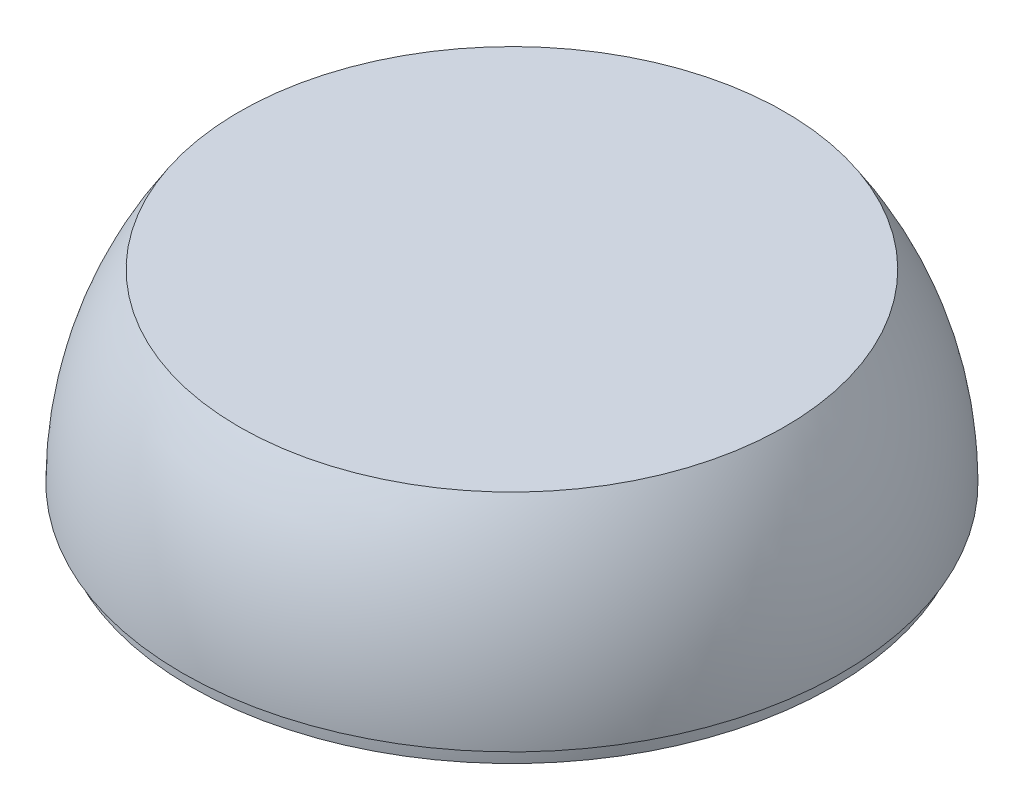
from build123d import *


with BuildPart() as part:
    # Sketch1 → Revolve3 (revolve)
    with BuildSketch(Plane.XY, mode=Mode.PRIVATE) as revolve3_sk:
        with BuildLine():
            Line((0, 0), (1, 0))
            ThreePointArc((1, 0), (1.012509778, -1.000312842), (1.050031289, -2))
            Line((1.050031289, -2), (2.051315812, -2))
            ThreePointArc((2.051315812, -2), (3.297318564, 9.975360272), (8.13664655, 21))
            Line((8.13664655, 21), (41, 21))
            Line((41, 21), (41, 23))
            Line((41, 23), (7.058874503, 23))
            ThreePointArc((7.058874503, 23), (1.804425343, 12.029419243), (0, 0))
        make_face()
    revolve(revolve3_sk.sketch.rotate(Axis((41, 23, 0), (0, -1, 0)), 270), axis=Axis((41, 23, 0), (0, -1, 0)))


solid = part.part
